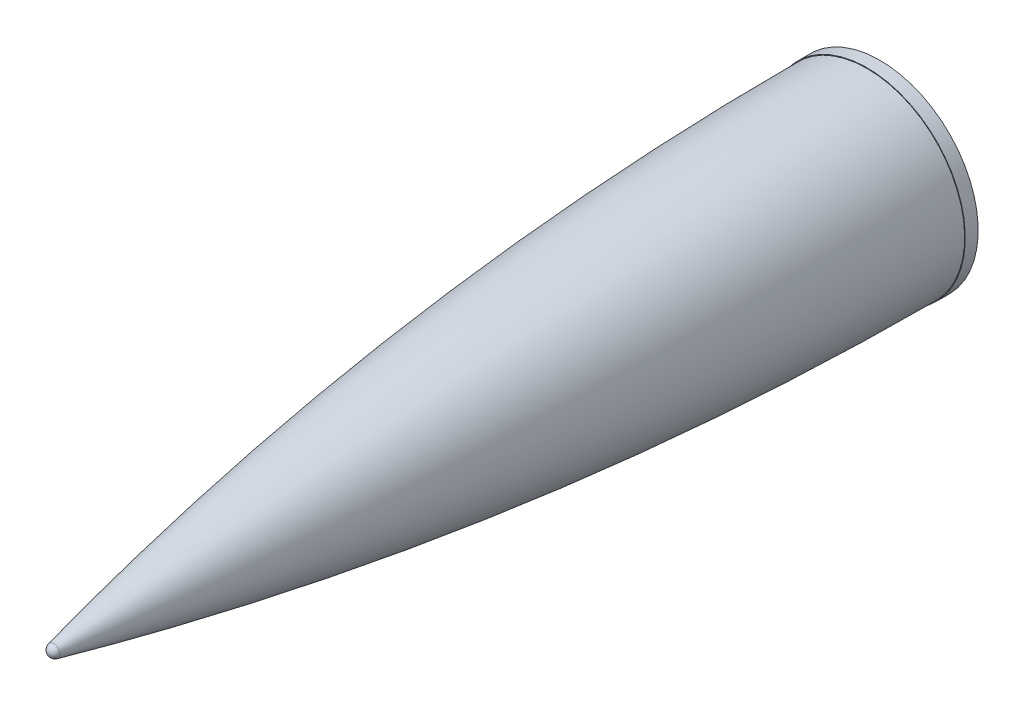
from build123d import *

# Parameters (mm, degrees)
SKETCH1_14_W = 152.4
SKETCH1_14_H = 20


with BuildPart() as part:
    # Sketch1<14> → Revolve9 (revolve)
    with BuildSketch(Plane.YZ, mode=Mode.PRIVATE) as revolve9_sk:
        with Locations((76.2, 4077.73873053)):
            Rectangle(SKETCH1_14_W, SKETCH1_14_H)
    revolve(revolve9_sk.sketch.rotate(Axis((0, 0, 4067.73873053), (0, 0, 1)), 90), axis=Axis((0, 0, 4067.73873053), (0, 0, 1)))

    # Sketch1<18> → Revolve-Thin9 (revolve)
    with BuildSketch(Plane.YZ):
        with BuildLine():
            ThreePointArc((0, 5357.73873053), (6.238377253, 5355.554269491), (9.751256095, 5349.955260381))
            ThreePointArc((9.751256095, 5349.955260381), (115.877016875, 4722.808595757), (151.4, 4087.73873053))
            Line((151.4, 4087.73873053), (150.4, 4087.73873053))
            ThreePointArc((150.4, 4087.73873053), (114.883254929, 4722.697073583), (8.776130485, 5349.733607396))
            ThreePointArc((8.776130485, 5349.733607396), (5.614539527, 5354.772715595), (0, 5356.73873053))
            Line((0, 5356.73873053), (0, 5357.73873053))
        make_face()
    revolve(axis=Axis((0, 0, 2579.7350764), (0, 0, 1)))


solid = part.part
